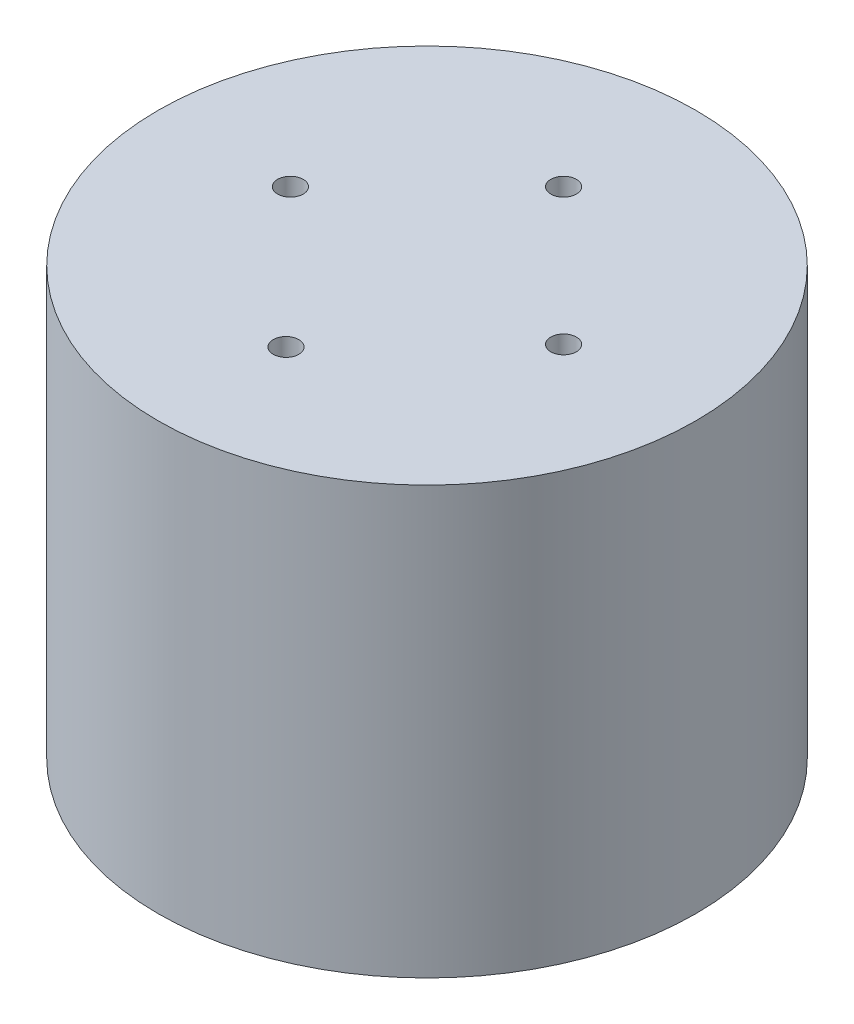
from build123d import *

# Parameters (mm, degrees)
ESQUISSE1_R              = 31.5
BOSS_EXTRU_1_DEPTH       = 50
ESQUISSE2_R              = 26
ENL_V_MAT_EXTRU_1_DEPTH  = 20
ESQUISSE3_R              = 11
ENL_V_MAT_EXTRU_5_DEPTH  = 7.5
ESQUISSE4_R              = 3.25
ENL_V_MAT_EXTRU_6_DEPTH  = 13.5
ESQUISSE11_R             = 1.5
ENL_V_MAT_EXTRU_11_DEPTH = 67.96640949


with BuildPart() as part:
    # Esquisse1 → Boss.-Extru.1 (new body)
    with BuildSketch(Plane(origin=(0, 0, 0), x_dir=(1, 0, 0), z_dir=(0, 1, 0))):
        with Locations(Location((0, 0, 0), (0, 0, 270))):
            Circle(ESQUISSE1_R)
    extrude(amount=BOSS_EXTRU_1_DEPTH)

    # Esquisse2 → Enlèv. mat.-Extru.1 (cut)
    with BuildSketch(Plane(origin=(0, 0, 0), x_dir=(-1, 0, 0), z_dir=(0, -1, 0))):
        with Locations(Location((0, 0, 0), (0, 0, 90))):
            Circle(ESQUISSE2_R)
    extrude(amount=-ENL_V_MAT_EXTRU_1_DEPTH, mode=Mode.SUBTRACT)

    # Esquisse3 → Enlèv. mat.-Extru.5 (cut)
    with BuildSketch(Plane(origin=(0, 20, 0), x_dir=(-1, 0, 0), z_dir=(0, -1, 0))):
        with Locations(Location((0, 0, 0), (0, 0, 90))):
            Circle(ESQUISSE3_R)
    extrude(amount=-ENL_V_MAT_EXTRU_5_DEPTH, mode=Mode.SUBTRACT)

    # Esquisse4 → Enlèv. mat.-Extru.6 (cut)
    with BuildSketch(Plane(origin=(0, 27.5, 0), x_dir=(-1, 0, 0), z_dir=(0, -1, 0))):
        with Locations(Location((0, 0, 0), (0, 0, 90))):
            Circle(ESQUISSE4_R)
    extrude(amount=-ENL_V_MAT_EXTRU_6_DEPTH, mode=Mode.SUBTRACT)

    # Esquisse11 → Enlèv. mat.-Extru.11 (cut, through all)
    with BuildSketch(Plane(origin=(0, 50, 0), x_dir=(1, 0, 0), z_dir=(0, 1, 0))):
        with Locations(Location((-16, 0, 0), (0, 0, 270))):
            Circle(ESQUISSE11_R)
        with Locations(Location((0, 16, 0), (0, 0, 270))):
            Circle(ESQUISSE11_R)
        with Locations(Location((16, 0, 0), (0, 0, 270))):
            Circle(ESQUISSE11_R)
        with Locations(Location((0, -16.513466974, 0), (0, 0, 270))):
            Circle(ESQUISSE11_R)
    extrude(amount=-ENL_V_MAT_EXTRU_11_DEPTH, mode=Mode.SUBTRACT)


solid = part.part
